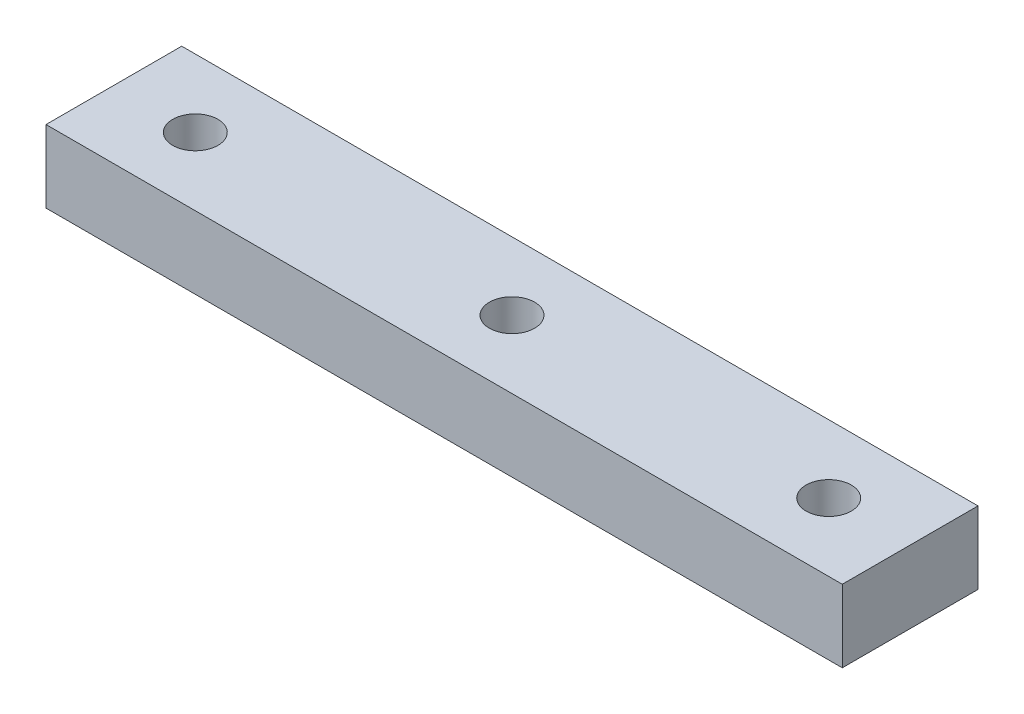
from build123d import *

# Parameters (mm, degrees)
SKETCH_2_W         = 88
SKETCH_2_H         = 8
EXTRUDE_1_DEPTH    = 7.5
HOLE_WIZARD_M6_1_D = 5


with BuildPart() as part:
    # 草图2 → 凸台-拉伸1 (new, symmetric)
    with BuildSketch(Plane.XY):
        Rectangle(SKETCH_2_W, SKETCH_2_H)
    extrude(amount=EXTRUDE_1_DEPTH, both=True)

    # M6 螺纹孔1 (through all)
    with Locations(Plane(origin=(0, -4, 0), x_dir=(-1, 0, 0), z_dir=(0, -1, 0))):
        with Locations((35, 0), (-35, 0), (0, 0)):
            Hole(HOLE_WIZARD_M6_1_D / 2)


solid = part.part
